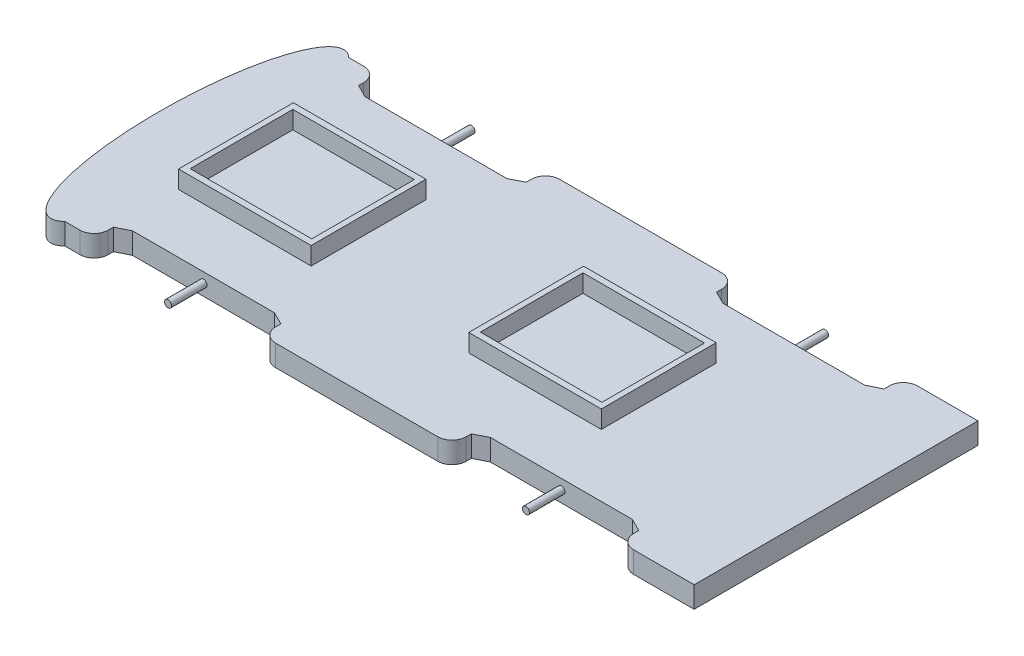
from build123d import *

# Parameters (mm, degrees)
BOSS_EXTRUDE1_DEPTH = 7.62
SKETCH3_R           = 1.27
BOSS_EXTRUDE4_DEPTH = 12.7
SKETCH4_R           = 1.27
BOSS_EXTRUDE5_DEPTH = 12.7
SKETCH5_W           = 47.441949355
SKETCH5_H           = 41.090366136
SKETCH5_W_2         = 43.519244155
SKETCH5_H_2         = 36.739621486
BOSS_EXTRUDE7_DEPTH = 6.35
FILLET12_R          = 5.08


with BuildPart() as part:
    # Sketch1 → Boss-Extrude1 (new body)
    with BuildSketch(Plane(origin=(0, 0, 0), x_dir=(1, 0, 0), z_dir=(0, 1, 0))):
        with BuildLine():
            Line((-87.779503071, 43.889751536), (-87.779503071, 50.8))
            Line((-87.779503071, 50.8), (-98.214639932, 50.8))
            add(Edge.make_bspline(
                [(-98.214639932, 50.8), (-115.420496929, 67.280501768), (-115.420496929, 0), (-115.420496929, -67.280501768), (-98.214639932, -50.8)],
                knots=[2.894122342, 2.894122342, 2.894122342, 4.71238898, 4.71238898, 6.530655618, 6.530655618, 6.530655618], degree=2, weights=[1, 0.614429767, 1, 0.614429767, 1]))
            Line((-98.214639932, -50.8), (-87.779503071, -50.8))
            Line((-87.779503071, -50.8), (-87.779503071, -43.889751536))
            Line((-87.779503071, -43.889751536), (-83.207503071, -41.603751536))
            Line((-83.207503071, -41.603751536), (-32.407503071, -41.603751536))
            Line((-32.407503071, -41.603751536), (-27.835503071, -43.889751536))
            Line((-27.835503071, -43.889751536), (-27.835503071, -50.8))
            Line((-27.835503071, -50.8), (40.337553716, -50.8))
            Line((40.337553716, -50.8), (40.337553716, -43.889751536))
            Line((40.337553716, -43.889751536), (44.909553716, -41.603751536))
            Line((44.909553716, -41.603751536), (95.709553716, -41.603751536))
            Line((95.709553716, -41.603751536), (100.281553716, -43.889751536))
            Line((100.281553716, -43.889751536), (100.281553716, -50.8))
            Line((100.281553716, -50.8), (127, -50.8))
            Line((127, -50.8), (127, 50.8))
            Line((127, 50.8), (100.281553716, 50.8))
            Line((100.281553716, 50.8), (100.281553716, 43.889751536))
            Line((100.281553716, 43.889751536), (95.709553716, 41.603751536))
            Line((95.709553716, 41.603751536), (44.909553716, 41.603751536))
            Line((44.909553716, 41.603751536), (40.337553716, 43.889751536))
            Line((40.337553716, 43.889751536), (40.337553716, 50.8))
            Line((40.337553716, 50.8), (-27.835503071, 50.8))
            Line((-27.835503071, 50.8), (-27.835503071, 43.889751536))
            Line((-27.835503071, 43.889751536), (-32.407503071, 41.603751536))
            Line((-32.407503071, 41.603751536), (-83.207503071, 41.603751536))
            Line((-83.207503071, 41.603751536), (-87.779503071, 43.889751536))
        make_face()
    extrude(amount=BOSS_EXTRUDE1_DEPTH)

    # Sketch3 → Boss-Extrude4 (add)
    with BuildSketch(Plane.XY.offset(41.603751536)):
        with Locations(Location((-57.807503071, 4.063832654, 0), (0, 0, 180))):
            Circle(SKETCH3_R)
        with Locations(Location((70.309553716, 4.063832654, 0), (0, 0, 180))):
            Circle(SKETCH3_R)
    extrude(amount=BOSS_EXTRUDE4_DEPTH)

    # Sketch4 → Boss-Extrude5 (add)
    with BuildSketch(Plane(origin=(0, 0, -41.603751536), x_dir=(-1, 0, 0), z_dir=(0, 0, -1))):
        with Locations(Location((-68.740249833, 3.81, 0), (0, 0, 180))):
            Circle(SKETCH4_R)
        with Locations(Location((57.807503071, 3.81, 0), (0, 0, 180))):
            Circle(SKETCH4_R)
    extrude(amount=BOSS_EXTRUDE5_DEPTH)

    # Sketch5 → Boss-Extrude7 (add)
    # profile 1 of 2: a face of its own
    with BuildSketch(Plane(origin=(0, 7.62, 0), x_dir=(1, 0, 0), z_dir=(0, 1, 0))):
        with Locations((-64.058528394, 0)):
            Rectangle(SKETCH5_W, SKETCH5_H)
        with Locations((-64.058528394, 0)):
            Rectangle(SKETCH5_W_2, SKETCH5_H_2, mode=Mode.SUBTRACT)
    # profile 2 of 2: a face of its own
    with BuildSketch(Plane(origin=(0, 7.62, 0), x_dir=(1, 0, 0), z_dir=(0, 1, 0))):
        with Locations((38.534163957, 1.269163272)):
            Rectangle(SKETCH5_W, SKETCH5_H)
        with Locations((38.534163957, 1.269163272)):
            Rectangle(SKETCH5_W_2, SKETCH5_H_2, mode=Mode.SUBTRACT)
    extrude(amount=BOSS_EXTRUDE7_DEPTH)

    # Fillet12
    fillet12_edges = [part.edges().sort_by_distance(p)[0] for p in [
        (-87.779503071, 3.81, -50.8),
        (-27.835503071, 3.81, -50.8),
        (40.337553716, 3.81, -50.8),
        (100.281553716, 3.81, -50.8),
        (100.281553716, 3.81, 50.8),
        (40.337553716, 3.81, 50.8),
        (-27.835503071, 3.81, 50.8),
        (-87.779503071, 3.81, 50.8),
    ]]
    fillet(fillet12_edges, radius=FILLET12_R)


solid = part.part
